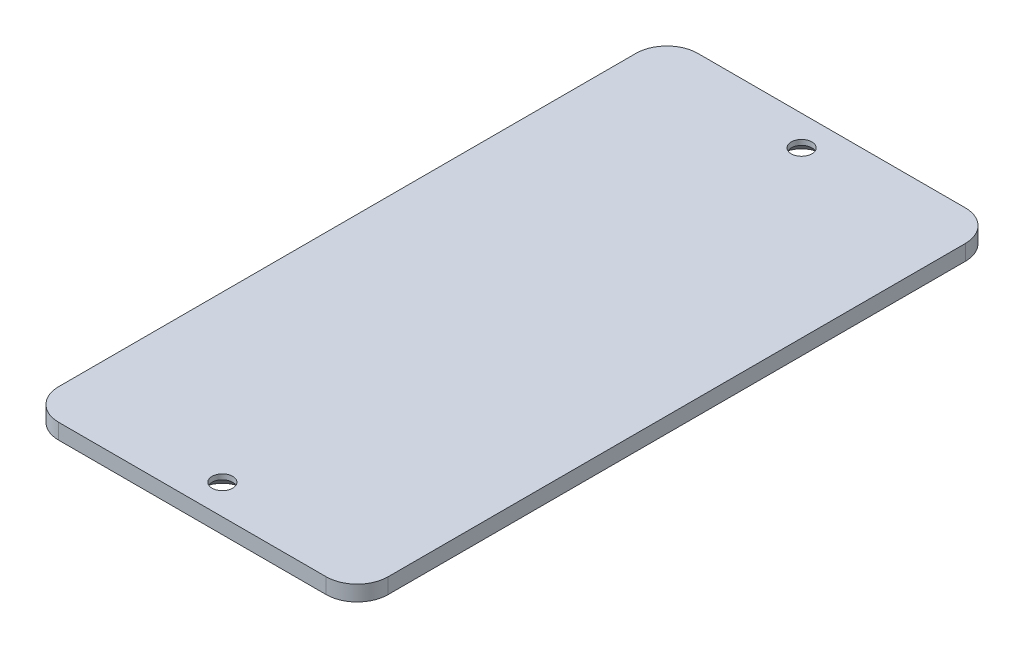
from build123d import *

# Parameters (mm, degrees)
SKETCH1_W           = 63.8
SKETCH1_H           = 123.8
BOSS_EXTRUDE1_DEPTH = 3
SKETCH2_R           = 2
CUT_EXTRUDE1_DEPTH  = 70.700932562
FILLET1_R           = 6


with BuildPart() as part:
    # Sketch1 → Boss-Extrude1 (new body)
    with BuildSketch(Plane(origin=(0, 0, 0), x_dir=(1, 0, 0), z_dir=(0, 1, 0))):
        Rectangle(SKETCH1_W, SKETCH1_H)
    extrude(amount=BOSS_EXTRUDE1_DEPTH)

    # Sketch2 → Cut-Extrude1 (cut, through all)
    with BuildSketch(Plane(origin=(0, 3, 0), x_dir=(1, 0, 0), z_dir=(0, 1, 0))):
        with Locations(Location((0, -56.1, 0), (0, 0, 270))):
            Circle(SKETCH2_R)
    cut_extrude1 = extrude(amount=-CUT_EXTRUDE1_DEPTH, mode=Mode.SUBTRACT)

    # Sketch3 → CSK for M4 Hex Socket Countersunk Head Screw1 (revolve, cut)
    with BuildSketch(Plane(origin=(0, 0, 56.1), x_dir=(0, 0, -1), z_dir=(1, 0, 0))):
        Polygon((0, 0), (0, 3), (2, 3), (2, 2), (4, 0), align=None)
    csk_for_m4_hex_socket_countersunk_head_s = revolve(axis=Axis((0, -6.35, 56.1), (0, 1, 0)), mode=Mode.SUBTRACT)

    # Mirror1: Cut-Extrude1, CSK for M4 Hex Socket Countersunk Head Screw1 across plane
    add(cut_extrude1.mirror(Plane.XY), mode=Mode.SUBTRACT)
    add(csk_for_m4_hex_socket_countersunk_head_s.mirror(Plane.XY), mode=Mode.SUBTRACT)

    # Fillet1
    fillet1_edges = [part.edges().sort_by_distance(p)[0] for p in [
        (31.9, 1.5, 61.9),
        (-31.9, 1.5, 61.9),
        (-31.9, 1.5, -61.9),
        (31.9, 1.5, -61.9),
    ]]
    fillet(fillet1_edges, radius=FILLET1_R)


solid = part.part
